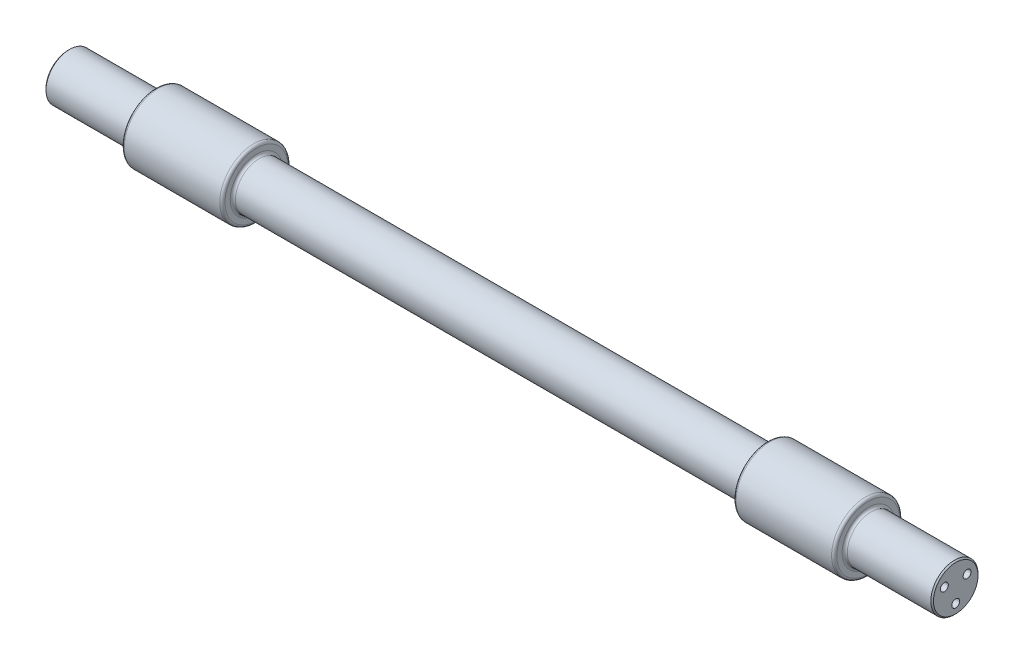
from build123d import *

# Parameters (mm, degrees)
SKETCH2_R               = 15
CUT_EXTRUDE1_DEPTH      = 50
CIRPATTERN1_COUNT       = 3
MIRROR1_COPY_1_SKETCH_R = 15
MIRROR1_COPY_1_DEPTH    = 50
MIRROR1_COPY_2_SKETCH_R = 15
MIRROR1_COPY_2_DEPTH    = 50
FILLET1_R               = 10
CHAMFER1_SIZE           = 5


with BuildPart() as part:
    # Sketch1 → Revolve1 (revolve)
    with BuildSketch(Plane.XY):
        Polygon((0, 0), (-3385, 0), (-3385, 90), (-3051.5, 90), (-3051.5, 130), (-2667.25, 130), (-2667.25, 90), (-717.75, 90), (-717.75, 130), (-333.5, 130), (-333.5, 90), (0, 90), align=None)
    revolve(axis=Axis((0, 0, 0), (-1, 0, 0)))

    # Sketch2 → Cut-Extrude1 (cut)
    with BuildSketch(Plane.ZY.offset(3385)):
        with Locations(Location((0, -50, 0), (0, 0, 270))):
            Circle(SKETCH2_R)
    cut_extrude1 = extrude(amount=-CUT_EXTRUDE1_DEPTH, mode=Mode.SUBTRACT)

    # CirPattern1: Cut-Extrude1 ×3 about axis
    cirpattern1_axis = Axis((0, 0, 0), (1, 0, 0))
    for i in range(1, CIRPATTERN1_COUNT):
        add(cut_extrude1.rotate(cirpattern1_axis, i * 360 / CIRPATTERN1_COUNT), mode=Mode.SUBTRACT)

    # Mirror1: Cut-Extrude1 across plane
    add(cut_extrude1.mirror(Plane.ZY.offset(1692.5)), mode=Mode.SUBTRACT)

    # Mirror1 copy 1 sketch → Mirror1 copy 1 (cut)
    with BuildSketch(Plane(origin=(0, 0, 0), x_dir=(0, -0.8660254037844387, -0.4999999999999998), z_dir=(1, 0, 0))):
        with Locations((0, 50)):
            Circle(MIRROR1_COPY_1_SKETCH_R)
    extrude(amount=-MIRROR1_COPY_1_DEPTH, mode=Mode.SUBTRACT)

    # Mirror1 copy 2 sketch → Mirror1 copy 2 (cut)
    with BuildSketch(Plane(origin=(0, 0, 0), x_dir=(0, 0.8660254037844384, -0.5000000000000004), z_dir=(1, 0, 0))):
        with Locations((0, 50)):
            Circle(MIRROR1_COPY_2_SKETCH_R)
    extrude(amount=-MIRROR1_COPY_2_DEPTH, mode=Mode.SUBTRACT)

    # Fillet1
    fillet1_edges = [part.edges().sort_by_distance(p)[0] for p in [
        (-717.75, -90, 0),
        (-2667.25, -90, 0),
        (-2667.25, -130, 0),
        (-3051.5, -130, 0),
        (-3051.5, -90, 0),
        (-333.5, -90, 0),
        (-333.5, -130, 0),
        (-717.75, -130, 0),
    ]]
    fillet(fillet1_edges, radius=FILLET1_R)

    # Chamfer1
    chamfer1_edges = [part.edges().sort_by_distance(p)[0] for p in [
        (-3385, -90, 0),
        (0, -90, 0),
    ]]
    chamfer(chamfer1_edges, length=CHAMFER1_SIZE)


solid = part.part
